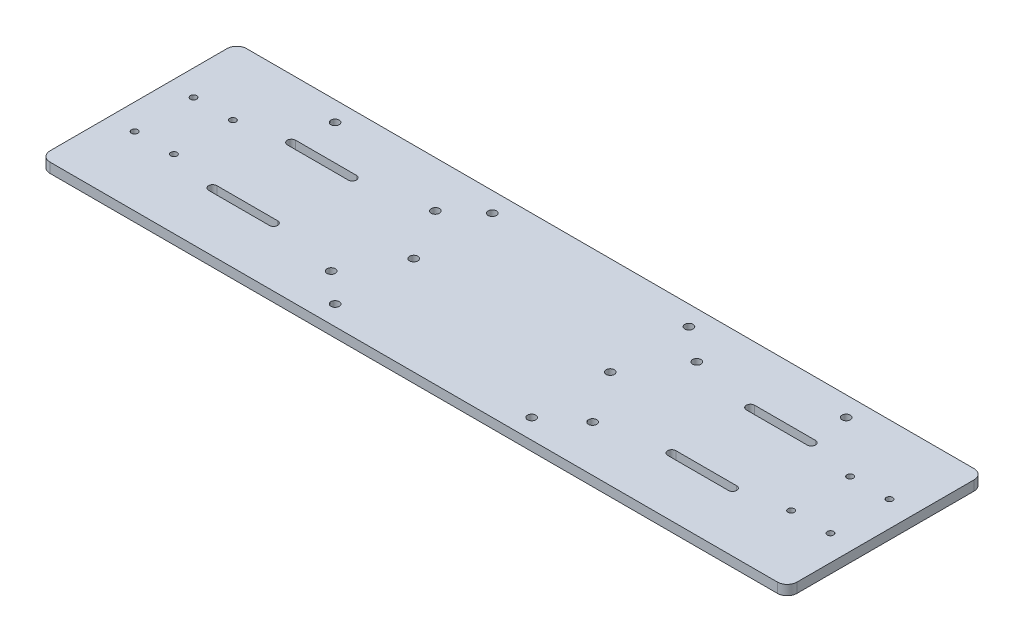
from build123d import *

# Parameters (mm, degrees)
SKETCH_1_W                       = 380
SKETCH_1_H                       = 100
EXTRUDE_1_DEPTH                  = 5
FILLET_2_R                       = 5
SKETCH_2_R                       = 1.6
CUT_EXTRUDE_1_DEPTH              = 197.53244007
PATTERN_LINEAR_1_COUNT           = 2
PATTERN_LINEAR_1_PITCH           = 20
MIRROR_1_COPY_1_SKETCH_R         = 1.6
MIRROR_1_COPY_1_DEPTH            = 197.53244007
MIRROR_2_COPY_1_SKETCH_R         = 1.6
MIRROR_2_COPY_1_DEPTH            = 197.53244007
MIRROR_2_COPY_2_SKETCH_R         = 1.6
MIRROR_2_COPY_2_DEPTH            = 197.53244007
MIRROR_2_COPY_3_SKETCH_R         = 1.6
MIRROR_2_COPY_3_DEPTH            = 197.53244007
SKETCH_3_R                       = 2.1
CUT_EXTRUDE_2_DEPTH              = 197.53244007
PATTERN_LINEAR_2_COUNT           = 3
PATTERN_LINEAR_2_PITCH           = 40
MIRROR_3_COPY_1_SKETCH_R         = 2.1
MIRROR_3_COPY_1_DEPTH            = 197.53244007
MIRROR_3_COPY_2_SKETCH_R         = 2.1
MIRROR_3_COPY_2_DEPTH            = 197.53244007
SKETCH_4_R                       = 2.1
CUT_EXTRUDE_3_DEPTH              = 197.53244007
PATTERN_LINEAR_3_COUNT           = 2
PATTERN_LINEAR_3_PITCH           = 133
PATTERN_LINEAR_3_COPY_1_SKETCH_R = 2.1
PATTERN_LINEAR_3_COPY_1_DEPTH    = 197.53244007
PATTERN_LINEAR_4_COUNT           = 2
PATTERN_LINEAR_4_PITCH           = 80
MIRROR_5_COPY_1_SKETCH_R         = 2.1
MIRROR_5_COPY_1_DEPTH            = 197.53244007
MIRROR_5_COPY_2_SKETCH_R         = 2.1
MIRROR_5_COPY_2_DEPTH            = 197.53244007
CUT_EXTRUDE_4_DEPTH              = 197.53244007
MIRROR_7_COPY_1_DEPTH            = 197.53244007


with BuildPart() as part:
    # 草图1 → 凸台-拉伸1 (new body)
    with BuildSketch(Plane(origin=(0, 0, 0), x_dir=(1, 0, 0), z_dir=(0, 1, 0))):
        Rectangle(SKETCH_1_W, SKETCH_1_H)
    extrude(amount=EXTRUDE_1_DEPTH)

    # 圆角2
    fillet_2_edges = [part.edges().sort_by_distance(p)[0] for p in [
        (190, 2.5, 50),
        (-190, 2.5, 50),
        (-190, 2.5, -50),
        (190, 2.5, -50),
    ]]
    fillet(fillet_2_edges, radius=FILLET_2_R)

    # 草图2 → 切除-拉伸1 (cut, through all)
    with BuildSketch(Plane(origin=(0, 5, 0), x_dir=(1, 0, 0), z_dir=(0, 1, 0))):
        with Locations(Location((177, 15, 0), (0, 0, 270))):
            Circle(SKETCH_2_R)
    cut_extrude_1 = extrude(amount=-CUT_EXTRUDE_1_DEPTH, mode=Mode.SUBTRACT)

    # 阵列(线性)1: 切除-拉伸1 ×2
    with Locations(*[(-i * PATTERN_LINEAR_1_PITCH, 0, 0) for i in range(1, PATTERN_LINEAR_1_COUNT)]):
        add(cut_extrude_1, mode=Mode.SUBTRACT)

    # 镜向1: 切除-拉伸1 across plane
    add(cut_extrude_1.mirror(Plane.XY), mode=Mode.SUBTRACT)

    # 镜向1 copy 1 sketch → 镜向1 copy 1 (cut, through all)
    with BuildSketch(Plane(origin=(-20, 5, 0), x_dir=(1, 0, 0), z_dir=(0, 1, 0))):
        with Locations((177, -15)):
            Circle(MIRROR_1_COPY_1_SKETCH_R)
    extrude(amount=-MIRROR_1_COPY_1_DEPTH, mode=Mode.SUBTRACT)

    # 镜向2: 切除-拉伸1 across plane
    add(cut_extrude_1.mirror(Plane(origin=(0, 0, 0), x_dir=(0, 0, 1), z_dir=(1, 0, 0))), mode=Mode.SUBTRACT)

    # 镜向2 copy 1 sketch → 镜向2 copy 1 (cut, through all)
    with BuildSketch(Plane(origin=(20, 5, 0), x_dir=(-1, 0, 0), z_dir=(0, 1, 0))):
        with Locations((177, -15)):
            Circle(MIRROR_2_COPY_1_SKETCH_R)
    extrude(amount=-MIRROR_2_COPY_1_DEPTH, mode=Mode.SUBTRACT)

    # 镜向2 copy 2 sketch → 镜向2 copy 2 (cut, through all)
    with BuildSketch(Plane(origin=(0, 5, 0), x_dir=(-1, 0, 0), z_dir=(0, 1, 0))):
        with Locations(Location((177, 15, 0), (0, 0, 270))):
            Circle(MIRROR_2_COPY_2_SKETCH_R)
    extrude(amount=-MIRROR_2_COPY_2_DEPTH, mode=Mode.SUBTRACT)

    # 镜向2 copy 3 sketch → 镜向2 copy 3 (cut, through all)
    with BuildSketch(Plane(origin=(20, 5, 0), x_dir=(-1, 0, 0), z_dir=(0, 1, 0))):
        with Locations(Location((177, 15, 0), (0, 0, 270))):
            Circle(MIRROR_2_COPY_3_SKETCH_R)
    extrude(amount=-MIRROR_2_COPY_3_DEPTH, mode=Mode.SUBTRACT)

    # 草图3 → 切除-拉伸2 (cut, through all)
    with BuildSketch(Plane(origin=(0, 5, 0), x_dir=(1, 0, 0), z_dir=(0, 1, 0))):
        with Locations(Location((-50, 40, 0), (0, 0, 270))):
            Circle(SKETCH_3_R)
    cut_extrude_2 = extrude(amount=-CUT_EXTRUDE_2_DEPTH, mode=Mode.SUBTRACT)

    # 阵列(线性)2: 切除-拉伸2 ×3
    with Locations(*[(0, 0, i * PATTERN_LINEAR_2_PITCH) for i in range(1, PATTERN_LINEAR_2_COUNT)]):
        add(cut_extrude_2, mode=Mode.SUBTRACT)

    # 镜向3: 切除-拉伸2 across plane
    add(cut_extrude_2.mirror(Plane(origin=(0, 0, 0), x_dir=(0, 0, 1), z_dir=(1, 0, 0))), mode=Mode.SUBTRACT)

    # 镜向3 copy 1 sketch → 镜向3 copy 1 (cut, through all)
    with BuildSketch(Plane(origin=(0, 5, 40), x_dir=(-1, 0, 0), z_dir=(0, 1, 0))):
        with Locations((-50, -40)):
            Circle(MIRROR_3_COPY_1_SKETCH_R)
    extrude(amount=-MIRROR_3_COPY_1_DEPTH, mode=Mode.SUBTRACT)

    # 镜向3 copy 2 sketch → 镜向3 copy 2 (cut, through all)
    with BuildSketch(Plane(origin=(0, 5, 80), x_dir=(-1, 0, 0), z_dir=(0, 1, 0))):
        with Locations((-50, -40)):
            Circle(MIRROR_3_COPY_2_SKETCH_R)
    extrude(amount=-MIRROR_3_COPY_2_DEPTH, mode=Mode.SUBTRACT)

    # 草图4 → 切除-拉伸3 (cut, through all)
    with BuildSketch(Plane(origin=(0, 5, 0), x_dir=(1, 0, 0), z_dir=(0, 1, 0))):
        with Locations(Location((-65.5, -26.5, 0), (0, 0, 270))):
            Circle(SKETCH_4_R)
    cut_extrude_3 = extrude(amount=-CUT_EXTRUDE_3_DEPTH, mode=Mode.SUBTRACT)

    # 镜向4: 切除-拉伸3 across plane
    add(cut_extrude_3.mirror(Plane.XY), mode=Mode.SUBTRACT)

    # 阵列(线性)3: 切除-拉伸3 ×2
    with Locations(*[(i * PATTERN_LINEAR_3_PITCH, 0, 0) for i in range(1, PATTERN_LINEAR_3_COUNT)]):
        add(cut_extrude_3, mode=Mode.SUBTRACT)

    # 阵列(线性)3 copy 1 sketch → 阵列(线性)3 copy 1 (cut, through all)
    with BuildSketch(Plane(origin=(133, 5, 0), x_dir=(1, 0, 0), z_dir=(0, 1, 0))):
        with Locations((-65.5, 26.5)):
            Circle(PATTERN_LINEAR_3_COPY_1_SKETCH_R)
    extrude(amount=-PATTERN_LINEAR_3_COPY_1_DEPTH, mode=Mode.SUBTRACT)

    # 阵列(线性)4: 切除-拉伸2 ×2
    with Locations(*[(-i * PATTERN_LINEAR_4_PITCH, 0, 0) for i in range(1, PATTERN_LINEAR_4_COUNT)]):
        add(cut_extrude_2, mode=Mode.SUBTRACT)

    # 镜向5 copy 1 sketch → 镜向5 copy 1 (cut, through all)
    with BuildSketch(Plane(origin=(80, 5, 0), x_dir=(-1, 0, 0), z_dir=(0, 1, 0))):
        with Locations((-50, -40)):
            Circle(MIRROR_5_COPY_1_SKETCH_R)
    extrude(amount=-MIRROR_5_COPY_1_DEPTH, mode=Mode.SUBTRACT)

    # 镜向5 copy 2 sketch → 镜向5 copy 2 (cut, through all)
    with BuildSketch(Plane(origin=(0, 5, 0), x_dir=(-1, 0, 0), z_dir=(0, 1, 0))):
        with Locations((-50, -40)):
            Circle(MIRROR_5_COPY_2_SKETCH_R)
    extrude(amount=-MIRROR_5_COPY_2_DEPTH, mode=Mode.SUBTRACT)

    # 草图6 → 切除-拉伸4 (cut, through all)
    with BuildSketch(Plane(origin=(0, 5, 0), x_dir=(1, 0, 0), z_dir=(0, 1, 0))):
        with BuildLine():
            Line((-132.229853022, 22.110343678), (-101.2783764, 22.110343678))
            ThreePointArc((-101.2783764, 22.110343678), (-99.192992914, 20.024960192), (-101.2783764, 17.939576706))
            Line((-101.2783764, 17.939576706), (-132.229853022, 17.939576706))
            ThreePointArc((-132.229853022, 17.939576706), (-134.315236507, 20.024960192), (-132.229853022, 22.110343678))
        make_face()
    cut_extrude_4 = extrude(amount=-CUT_EXTRUDE_4_DEPTH, mode=Mode.SUBTRACT)

    # 镜向6: 切除-拉伸4 across plane
    add(cut_extrude_4.mirror(Plane.XY), mode=Mode.SUBTRACT)

    # 镜向7: 切除-拉伸4 across plane
    add(cut_extrude_4.mirror(Plane(origin=(0, 0, 0), x_dir=(0, 0, 1), z_dir=(1, 0, 0))), mode=Mode.SUBTRACT)

    # 镜向7 copy 1 sketch → 镜向7 copy 1 (cut, through all)
    with BuildSketch(Plane(origin=(0, 5, 0), x_dir=(-1, 0, 0), z_dir=(0, 1, 0))):
        with BuildLine():
            Line((-132.229853022, 22.110343678), (-101.2783764, 22.110343678))
            ThreePointArc((-101.2783764, 22.110343678), (-99.192992914, 20.024960192), (-101.2783764, 17.939576706))
            Line((-101.2783764, 17.939576706), (-132.229853022, 17.939576706))
            ThreePointArc((-132.229853022, 17.939576706), (-134.315236507, 20.024960192), (-132.229853022, 22.110343678))
        make_face()
    extrude(amount=-MIRROR_7_COPY_1_DEPTH, mode=Mode.SUBTRACT)


solid = part.part
